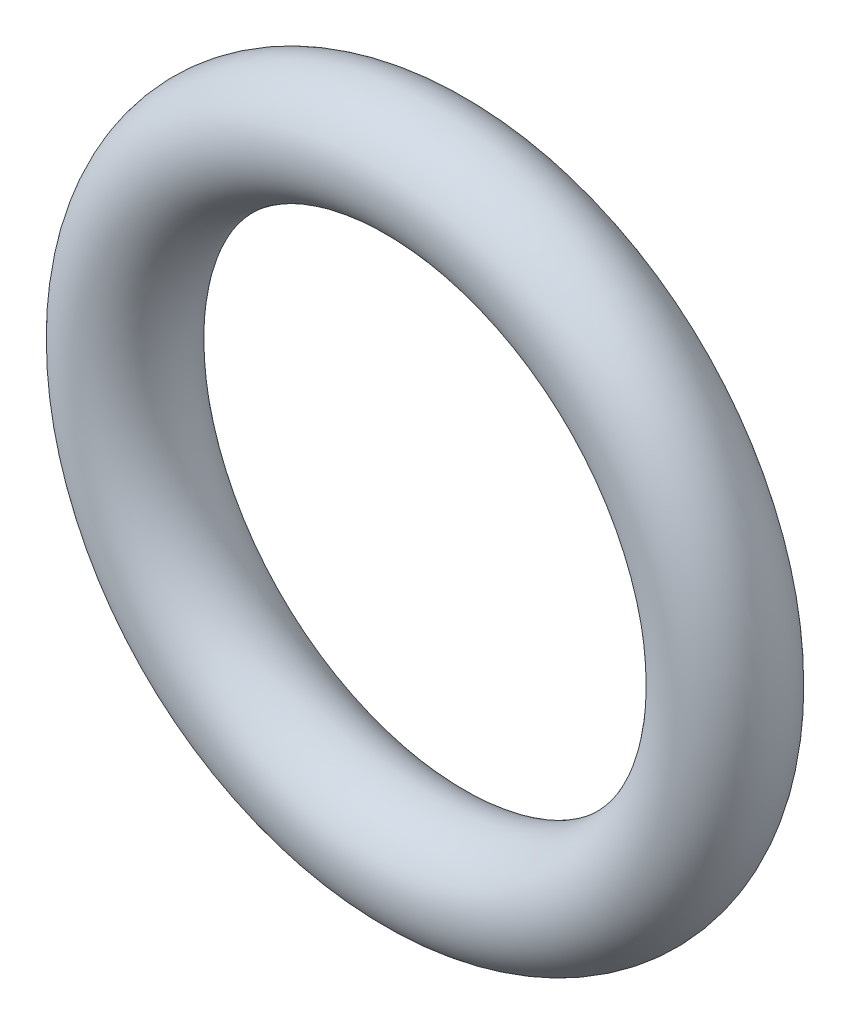
from build123d import *

# Parameters (mm, degrees)
SKETCH1_R = 1.7653


with BuildPart() as part:
    # Sketch1 → Revolve1 (revolve)
    with BuildSketch(Plane(origin=(0, 0, 0), x_dir=(0, -1, 0), z_dir=(1, 0, 0)), mode=Mode.PRIVATE) as revolve1_sk:
        with Locations((9.4996, 0)):
            Circle(SKETCH1_R)
    revolve(revolve1_sk.sketch.rotate(Axis((0, 0, 1.7653), (0, 0, -1)), 270), axis=Axis((0, 0, 1.7653), (0, 0, -1)))


solid = part.part
